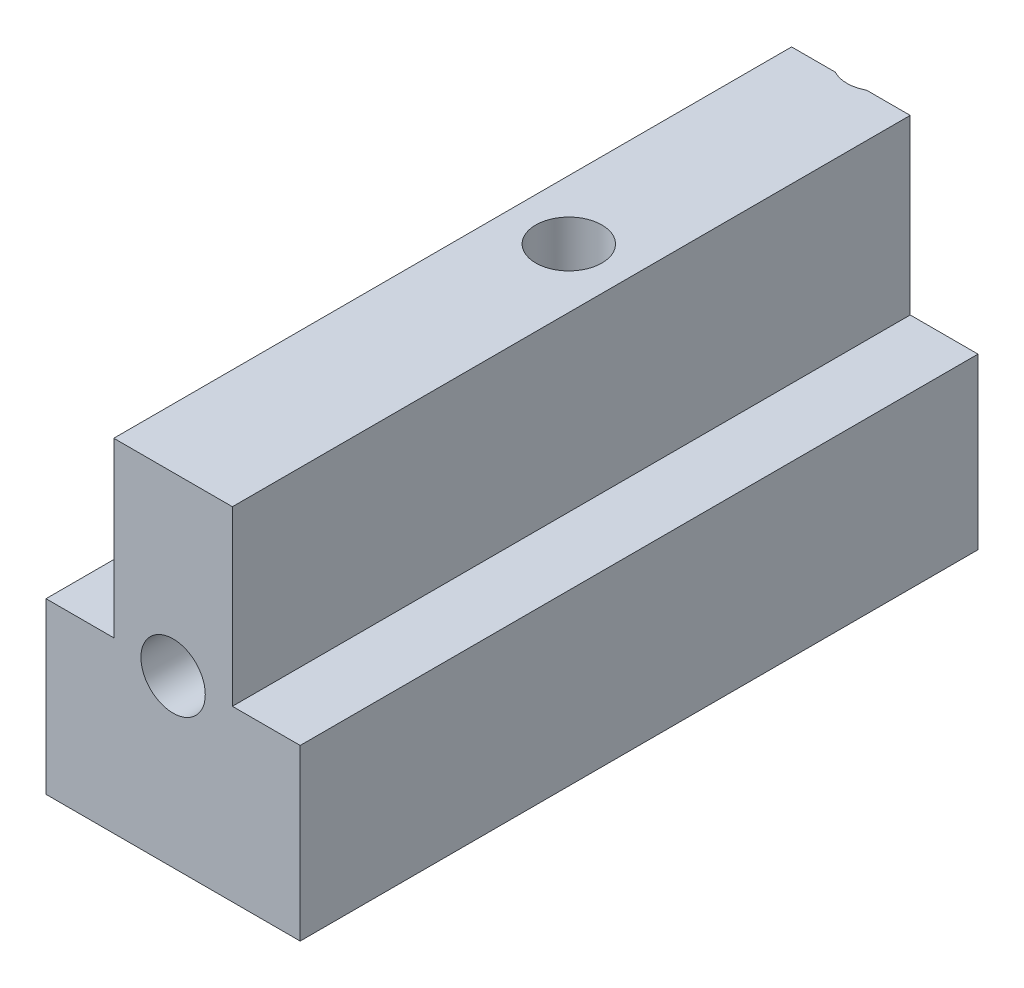
from build123d import *

# Parameters (mm, degrees)
BOSS_EXTRUDE1_DEPTH     = 20
SKETCH3_R               = 0.95
CUT_EXTRUDE1_DEPTH      = 5
CUT_EXTRUDE2_DEPTH      = 23.837378659
CUT_EXTRUDE2_DEPTH_BACK = 23.837378659
SKETCH4_R               = 0.975


with BuildPart() as part:
    # Sketch2 → Boss-Extrude1 (new body)
    with BuildSketch(Plane.XY):
        Polygon((-1.080060634, 2.442708333), (2.419939366, 2.442708333), (2.419939366, -2.657291667), (4.419939366, -2.657291667), (4.419939366, -7.657291667), (-3.080060634, -7.657291667), (-3.080060634, -2.657291667), (-1.080060634, -2.657291667), align=None)
    extrude(amount=BOSS_EXTRUDE1_DEPTH)

    # Sketch3 → Cut-Extrude1 (cut)
    with BuildSketch(Plane.XY.offset(20)):
        with Locations((0.669939366, -2.757291667)):
            Circle(SKETCH3_R)
    extrude(amount=-CUT_EXTRUDE1_DEPTH, mode=Mode.SUBTRACT)

    # Sketch4 → Cut-Extrude2 (cut, two sides: drawn at the far end of the back side and taken through both)
    with BuildSketch(Plane(origin=(0, 2.442708333, 0), x_dir=(1, 0, 0), z_dir=(0, 1, 0)).offset(-CUT_EXTRUDE2_DEPTH_BACK)):
        with Locations((0.669939366, -8.322927776)):
            Circle(SKETCH4_R)
        with Locations((0.669939366, 0.86)):
            Circle(SKETCH4_R)
    extrude(amount=CUT_EXTRUDE2_DEPTH + CUT_EXTRUDE2_DEPTH_BACK, mode=Mode.SUBTRACT)


solid = part.part
